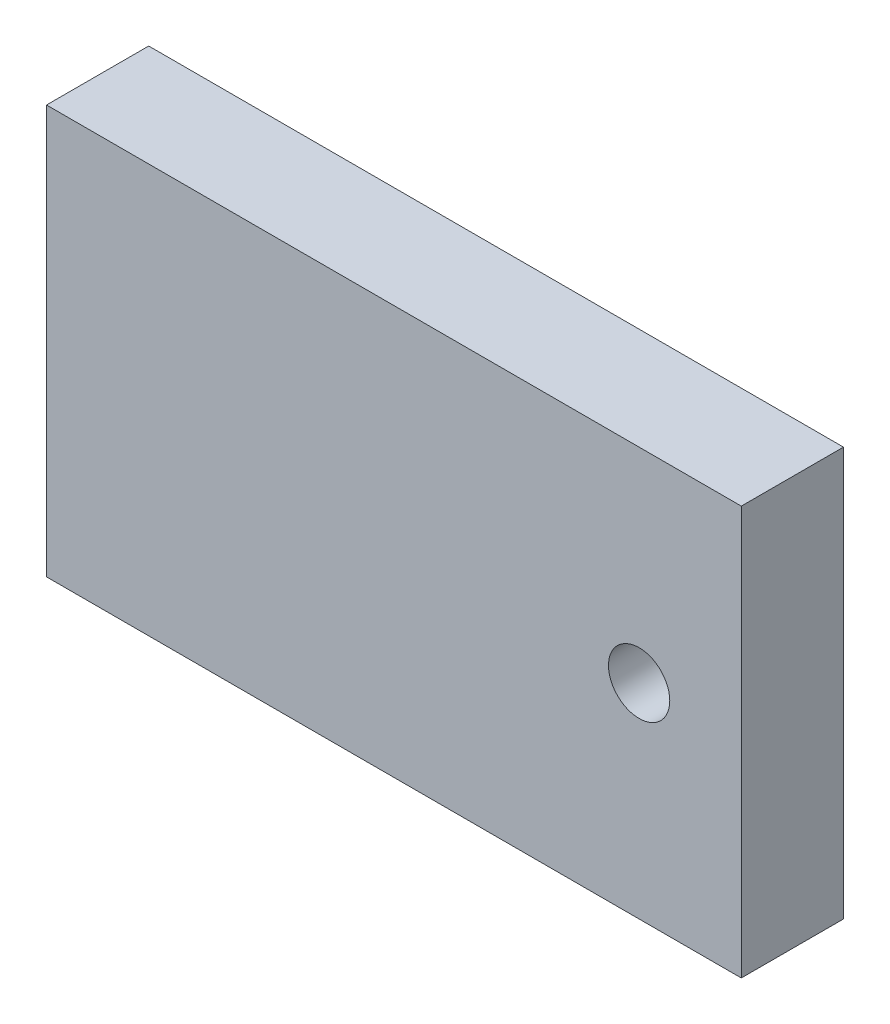
from build123d import *

# Parameters (mm, degrees)
SKETCH_1_W      = 34
SKETCH_1_H      = 20
SKETCH_1_R      = 1.5
EXTRUDE_1_DEPTH = 5


with BuildPart() as part:
    # 草图1 → 凸台-拉伸1 (new body)
    with BuildSketch(Plane.XY):
        with Locations((-12, 0)):
            Rectangle(SKETCH_1_W, SKETCH_1_H)
        Circle(SKETCH_1_R, mode=Mode.SUBTRACT)
    extrude(amount=EXTRUDE_1_DEPTH)


solid = part.part
